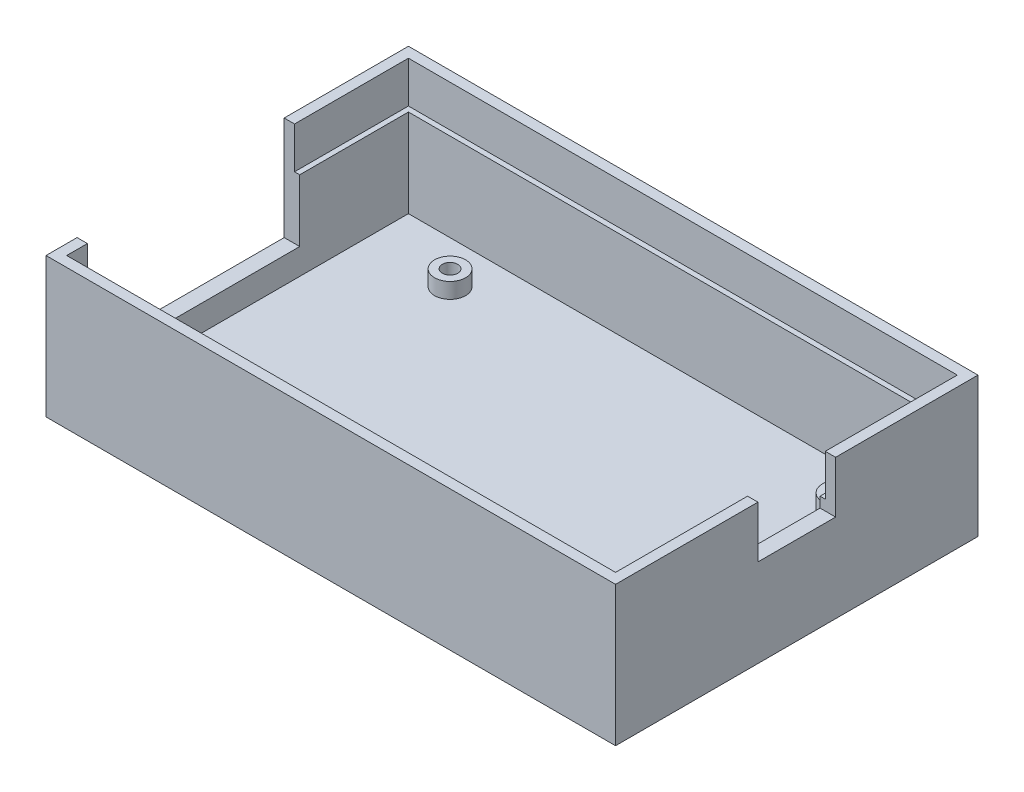
from build123d import *

# Parameters (mm, degrees)
CROQUIS1_W              = 110
CROQUIS1_H              = 70
SALIENTE_EXTRUIR1_DEPTH = 2
CROQUIS2_W              = 110
CROQUIS2_H              = 70
CROQUIS2_W_2            = 104
CROQUIS2_H_2            = 64
SALIENTE_EXTRUIR2_DEPTH = 25
CROQUIS3_W              = 106
CROQUIS3_H              = 66
CORTAR_EXTRUIR1_DEPTH   = 8
CROQUIS4_R              = 3
SALIENTE_EXTRUIR3_DEPTH = 3
CROQUIS6_R              = 1.5
CORTAR_EXTRUIR2_DEPTH   = 4
CROQUIS7_W              = 6
CROQUIS7_H              = 40
CORTAR_EXTRUIR3_DEPTH   = 20
CROQUIS8_W              = 9.353871772
CROQUIS8_H              = 15
CORTAR_EXTRUIR4_DEPTH   = 10


with BuildPart() as part:
    # Croquis1 → Saliente-Extruir1 (new body)
    with BuildSketch(Plane(origin=(0, 0, 0), x_dir=(1, 0, 0), z_dir=(0, 1, 0))):
        Rectangle(CROQUIS1_W, CROQUIS1_H)
    extrude(amount=SALIENTE_EXTRUIR1_DEPTH)

    # Croquis2 → Saliente-Extruir2 (add)
    with BuildSketch(Plane(origin=(0, 2, 0), x_dir=(1, 0, 0), z_dir=(0, 1, 0))):
        Rectangle(CROQUIS2_W, CROQUIS2_H)
        Rectangle(CROQUIS2_W_2, CROQUIS2_H_2, mode=Mode.SUBTRACT)
    extrude(amount=SALIENTE_EXTRUIR2_DEPTH)

    # Croquis3 → Cortar-Extruir1 (cut)
    with BuildSketch(Plane(origin=(0, 27, 0), x_dir=(1, 0, 0), z_dir=(0, 1, 0))):
        Rectangle(CROQUIS3_W, CROQUIS3_H)
    extrude(amount=-CORTAR_EXTRUIR1_DEPTH, mode=Mode.SUBTRACT)

    # Croquis4 → Saliente-Extruir3 (add)
    with BuildSketch(Plane(origin=(0, 2, 0), x_dir=(1, 0, 0), z_dir=(0, 1, 0))):
        with Locations(Location((-37.03, -24.46, 0), (0, 0, 90))):
            Circle(CROQUIS4_R)
        with Locations(Location((-35.76, 23.8, 0), (0, 0, 90))):
            Circle(CROQUIS4_R)
        with Locations(Location((39.17, 23.8, 0), (0, 0, 90))):
            Circle(CROQUIS4_R)
        with Locations(Location((45.52, -24.46, 0), (0, 0, 90))):
            Circle(CROQUIS4_R)
    extrude(amount=SALIENTE_EXTRUIR3_DEPTH)

    # Croquis6 → Cortar-Extruir2 (cut)
    with BuildSketch(Plane(origin=(0, 5, 0), x_dir=(1, 0, 0), z_dir=(0, 1, 0))):
        with Locations(Location((-35.76, 23.8, 0), (0, 0, 270))):
            Circle(CROQUIS6_R)
        with Locations(Location((-37.03, -24.46, 0), (0, 0, 270))):
            Circle(CROQUIS6_R)
        with Locations(Location((39.17, 23.8, 0), (0, 0, 270))):
            Circle(CROQUIS6_R)
        with Locations(Location((45.52, -24.46, 0), (0, 0, 270))):
            Circle(CROQUIS6_R)
    extrude(amount=-CORTAR_EXTRUIR2_DEPTH, mode=Mode.SUBTRACT)

    # Croquis7 → Cortar-Extruir3 (cut)
    with BuildSketch(Plane(origin=(0, 27, 0), x_dir=(1, 0, 0), z_dir=(0, 1, 0))):
        with Locations((-55, -9)):
            Rectangle(CROQUIS7_W, CROQUIS7_H)
    extrude(amount=-CORTAR_EXTRUIR3_DEPTH, mode=Mode.SUBTRACT)

    # Croquis8 → Cortar-Extruir4 (cut)
    with BuildSketch(Plane(origin=(0, 27, 0), x_dir=(1, 0, 0), z_dir=(0, 1, 0))):
        with Locations((53, 0)):
            Rectangle(CROQUIS8_W, CROQUIS8_H)
    extrude(amount=-CORTAR_EXTRUIR4_DEPTH, mode=Mode.SUBTRACT)


solid = part.part
